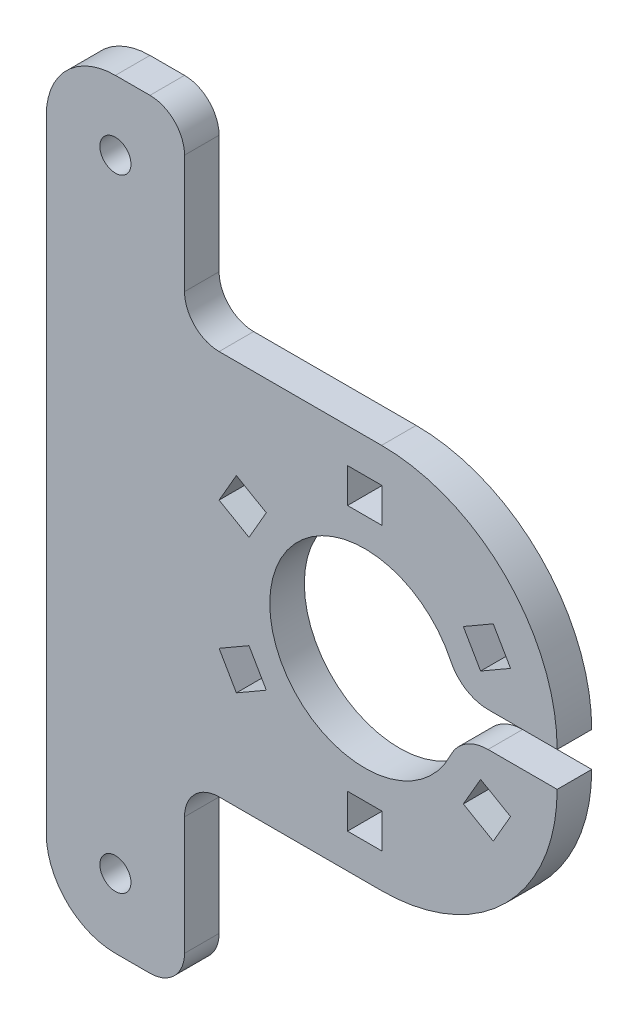
from build123d import *

# Parameters (mm, degrees)
ESQUISSE1_W        = 5
ESQUISSE1_H        = 5
BOSS_EXTRU_1_DEPTH = 5
D_GAGEMENT_M41_D   = 4.5


with BuildPart() as part:
    # Esquisse1 → Boss.-Extru.1 (new body)
    with BuildSketch(Plane.XY):
        with BuildLine():
            Line((-58.909278233, -55), (-63.909278233, -55))
            ThreePointArc((-63.909278233, -55), (-70.980346045, -52.071067812), (-73.909278233, -45))
            Line((-73.909278233, -45), (-73.909278233, 45))
            ThreePointArc((-73.909278233, 45), (-70.980346045, 52.071067812), (-63.909278233, 55))
            Line((-63.909278233, 55), (-58.909278233, 55))
            ThreePointArc((-58.909278233, 55), (-55.373744327, 53.535533906), (-53.909278233, 50))
            Line((-53.909278233, 50), (-53.909278233, 32.9))
            ThreePointArc((-53.909278233, 32.9), (-52.444812139, 29.364466094), (-48.909278233, 27.9))
            Line((-48.909278233, 27.9), (-25.4, 27.9))
            ThreePointArc((-25.4, 27.9), (-7.439487758, 20.460512242), (0, 2.5))
            Line((0, 2.5), (-10, 2.5))
            ThreePointArc((-10, 2.5), (-13.202056301, 3.42586604), (-15.41588754, 5.917721519))
            ThreePointArc((-15.41588754, 5.917721519), (-41.577296486, 0), (-15.41588754, -5.917721519))
            ThreePointArc((-15.41588754, -5.917721519), (-13.202056301, -3.42586604), (-10, -2.5))
            Line((-10, -2.5), (0, -2.5))
            ThreePointArc((0, -2.5), (-7.439487758, -20.460512242), (-25.4, -27.9))
            Line((-25.4, -27.9), (-48.909278233, -27.9))
            ThreePointArc((-48.909278233, -27.9), (-52.444812139, -29.364466094), (-53.909278233, -32.9))
            Line((-53.909278233, -32.9), (-53.909278233, -50))
            ThreePointArc((-53.909278233, -50), (-55.373744327, -53.535533906), (-58.909278233, -55))
        make_face()
        with Locations((-27.827296486, 20.4)):
            Rectangle(ESQUISSE1_W, ESQUISSE1_H, mode=Mode.SUBTRACT)
        Polygon((-9.245314739, 13.615063509), (-6.745314739, 9.284936491), (-11.075441758, 6.784936491), (-13.575441758, 11.115063509), align=None, mode=Mode.SUBTRACT)
        Polygon((-6.745314739, -9.284936491), (-9.245314739, -13.615063509), (-13.575441758, -11.115063509), (-11.075441758, -6.784936491), align=None, mode=Mode.SUBTRACT)
        with Locations((-27.827296486, -20.4)):
            Rectangle(ESQUISSE1_W, ESQUISSE1_H, mode=Mode.SUBTRACT)
        Polygon((-46.409278233, -13.615063509), (-48.909278233, -9.284936491), (-44.579151214, -6.784936491), (-42.079151214, -11.115063509), align=None, mode=Mode.SUBTRACT)
        Polygon((-48.909278233, 9.284936491), (-46.409278233, 13.615063509), (-42.079151214, 11.115063509), (-44.579151214, 6.784936491), align=None, mode=Mode.SUBTRACT)
    extrude(amount=BOSS_EXTRU_1_DEPTH)

    # Dégagement M41 (through all)
    with Locations(Plane.XY.offset(5)):
        with Locations((-63.909278233, 45), (-63.909278233, -45)):
            Hole(D_GAGEMENT_M41_D / 2)


solid = part.part
